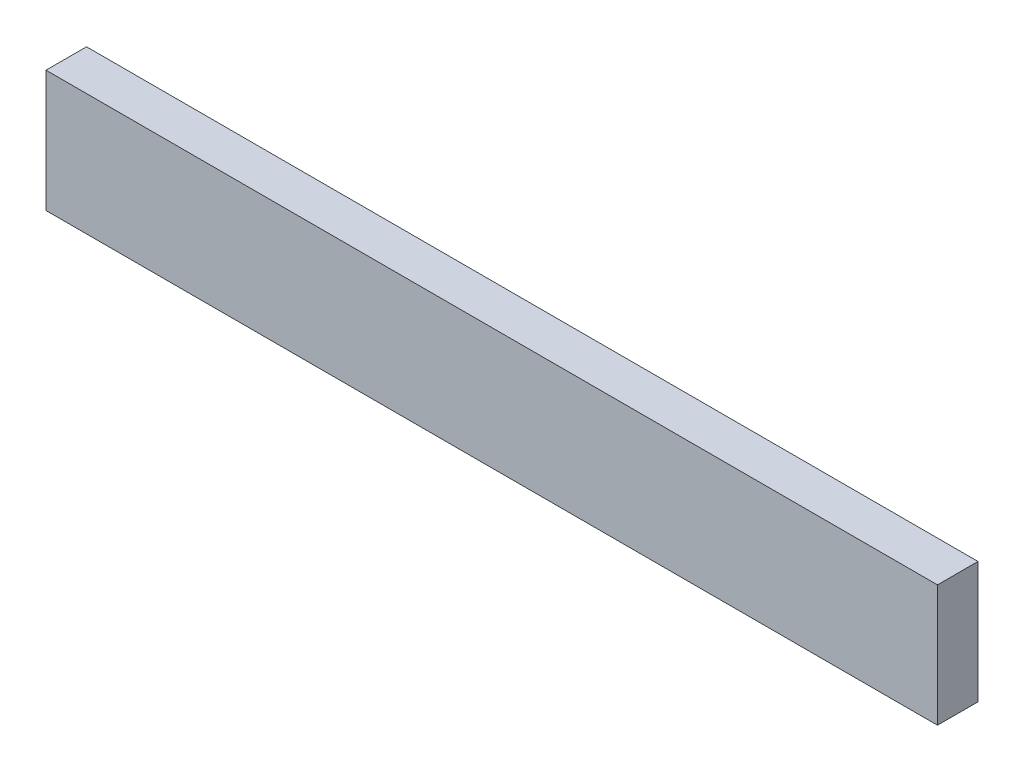
from build123d import *

# Parameters (mm, degrees)
ESBO_O1_W                = 110
ESBO_O1_H                = 15
RESSALTO_EXTRUS_O1_DEPTH = 5


with BuildPart() as part:
    # Esboço1 → Ressalto-extrusão1 (new body)
    with BuildSketch(Plane.XY):
        with Locations((-3.906999705, -20.694983064)):
            Rectangle(ESBO_O1_W, ESBO_O1_H)
    extrude(amount=RESSALTO_EXTRUS_O1_DEPTH)


solid = part.part
